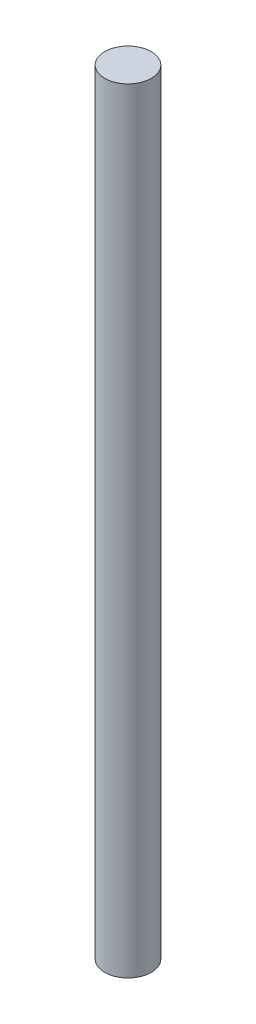
from build123d import *

# Parameters (mm, degrees)
SKETCH1_R           = 7.5
BOSS_EXTRUDE2_DEPTH = 250


with BuildPart() as part:
    # Sketch1 → Boss-Extrude2 (new body)
    with BuildSketch(Plane(origin=(0, 0, 0), x_dir=(1, 0, 0), z_dir=(0, 1, 0))):
        with Locations(Location((0, 0, 0), (0, 0, 270))):
            Circle(SKETCH1_R)
    extrude(amount=BOSS_EXTRUDE2_DEPTH)


solid = part.part
